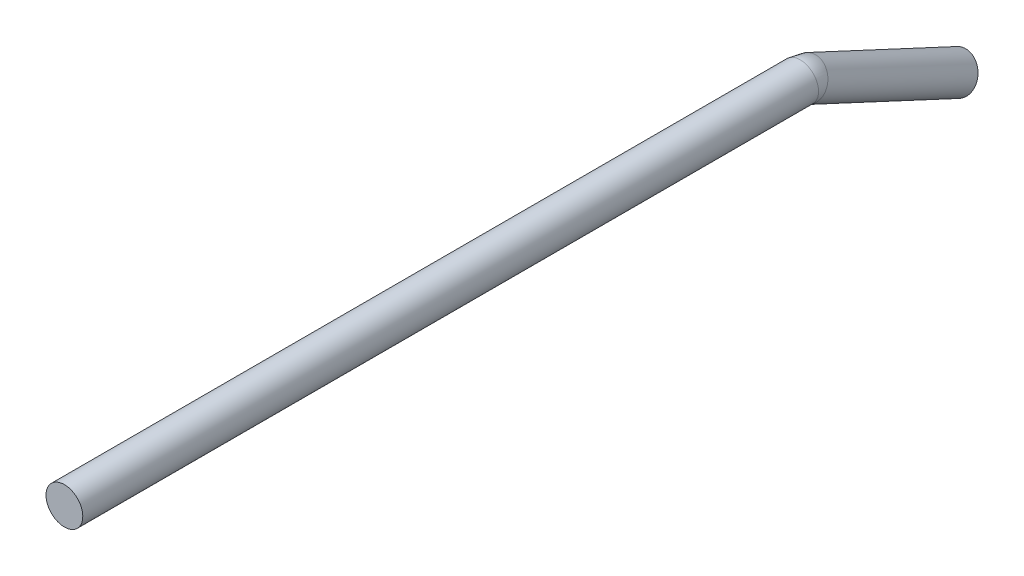
from build123d import *

# Parameters (mm, degrees)
SWEEP3_PROFILE_R = 10


with BuildPart() as part:
    # Sweep3: sweep along a path in Sketch4
    with BuildLine(Plane(origin=(0, 0, 0), x_dir=(0, 0, -1), z_dir=(1, 0, 0))) as sweep3_path:
        Line((-402.212339592, 0), (-2.212339592, 0))
        ThreePointArc((-2.212339592, 0), (-0.052231202, -0.236090345), (2.005881041, -0.933213651))
        Line((2.005881041, -0.933213651), (83.606958178, -38.897199349))
    # Sweep3 profile (on start of the path) → Sweep3 (sweep)
    with BuildSketch(Plane(origin=(0, 0, 402.212339592), x_dir=(0, -1, 0), z_dir=(0, 0, -1))):
        Circle(SWEEP3_PROFILE_R)
    sweep(path=sweep3_path.line)


solid = part.part
